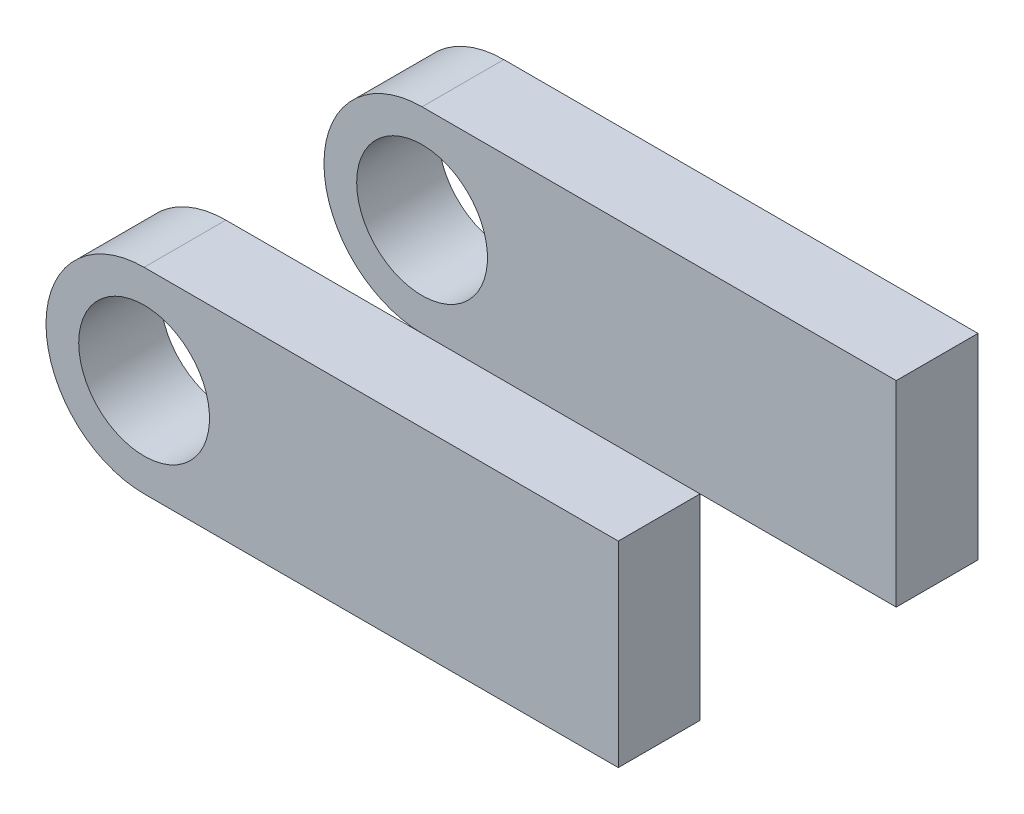
from build123d import *

# Parameters (mm, degrees)
SKETCH7_W             = 35
SKETCH7_H             = 5
BOSS_EXTRUDE3_DEPTH   = 12
BOSS_EXTRUDE3_2_DEPTH = 12
CUT_EXTRUDE9_DEPTH    = 22
SKETCH9_R             = 4
CUT_EXTRUDE10_DEPTH   = 22


with BuildPart() as part:
    # Sketch7 → Boss-Extrude3 (new body)
    with BuildSketch(Plane(origin=(0, 0, 0), x_dir=(1, 0, 0), z_dir=(0, 1, 0))):
        with Locations((17.5, 8.5)):
            Rectangle(SKETCH7_W, SKETCH7_H)
    extrude(amount=BOSS_EXTRUDE3_DEPTH)


with BuildPart() as body_2:
    # Sketch7 → Boss-Extrude3 2 (new body)
    with BuildSketch(Plane(origin=(0, 0, 0), x_dir=(1, 0, 0), z_dir=(0, 1, 0))):
        with Locations((17.5, -8.5)):
            Rectangle(SKETCH7_W, SKETCH7_H)
    extrude(amount=BOSS_EXTRUDE3_2_DEPTH)


with BuildPart() as cut_extrude9_tool:
    # Sketch8 → Cut-Extrude9 (new body)
    with BuildSketch(Plane(origin=(0, 0, -11), x_dir=(-1, 0, 0), z_dir=(0, 0, -1))):
        with BuildLine():
            Line((-6, 12), (6.269101311, 12))
            Line((6.269101311, 12), (6.269101311, 0))
            Line((6.269101311, 0), (-6, 0))
            ThreePointArc((-6, 0), (0, 6), (-6, 12))
        make_face()
    extrude(amount=-CUT_EXTRUDE9_DEPTH)


with BuildPart() as part_1:
    add(part.part)

    # Cut-Extrude9: cut by cut_extrude9_tool
    add(cut_extrude9_tool.part, mode=Mode.SUBTRACT)


with BuildPart() as body_2_1:
    add(body_2.part)

    # Cut-Extrude9: cut by cut_extrude9_tool
    add(cut_extrude9_tool.part, mode=Mode.SUBTRACT)


with BuildPart() as cut_extrude10_tool:
    # Sketch9 → Cut-Extrude10 (new body)
    with BuildSketch(Plane(origin=(0, 0, -11), x_dir=(-1, 0, 0), z_dir=(0, 0, -1))):
        with Locations((-6, 6)):
            Circle(SKETCH9_R)
    extrude(amount=-CUT_EXTRUDE10_DEPTH)


with BuildPart() as part_2:
    add(part_1.part)

    # Cut-Extrude10: cut by cut_extrude10_tool
    add(cut_extrude10_tool.part, mode=Mode.SUBTRACT)


with BuildPart() as body_2_2:
    add(body_2_1.part)

    # Cut-Extrude10: cut by cut_extrude10_tool
    add(cut_extrude10_tool.part, mode=Mode.SUBTRACT)


solid = Compound([part_2.part, body_2_2.part])
